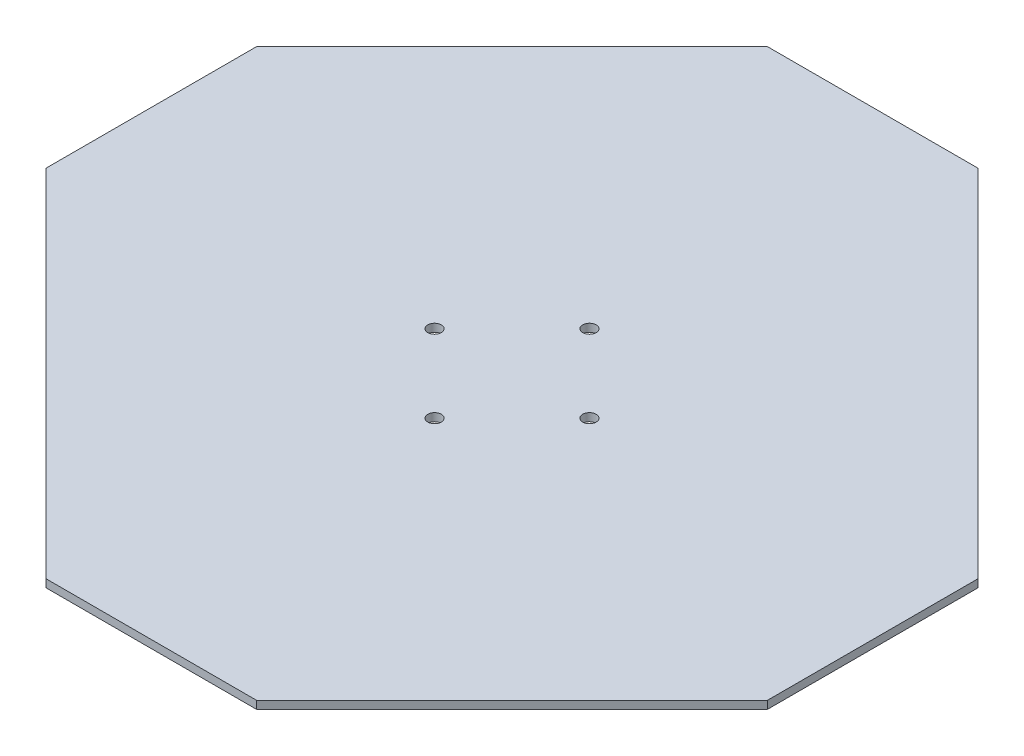
from build123d import *

# Parameters (mm, degrees)
BOSS_EXTRUDE2_DEPTH              = 3
F_13_64_0_20313_DIAMETER_HOLE1_D = 5.159502


with BuildPart() as part:
    # Sketch3 → Boss-Extrude2 (new body)
    with BuildSketch(Plane(origin=(0, 0, 0), x_dir=(1, 0, 0), z_dir=(0, 1, 0))):
        Polygon((146.917568262, 30.566233816), (11.506619665, 165.977182413), (-68.75, 165.977182413), (-165.977182413, 68.75), (-165.977182413, -11.506619665), (-30.566233816, -146.917568262), (49.690385849, -146.917568262), (146.917568262, -49.690385849), align=None)
    extrude(amount=BOSS_EXTRUDE2_DEPTH)

    # 13/64 (0.20313) Diameter Hole1 (through all)
    with Locations(Plane(origin=(0, 0, 0), x_dir=(-1, 0, 0), z_dir=(0, -1, 0))):
        with Locations((39.029807033, 9.528212544), (9.528212544, -19.970192881), (-19.970192881, 9.531401607), (9.531401607, 39.029807033)):
            Hole(F_13_64_0_20313_DIAMETER_HOLE1_D / 2)


solid = part.part
